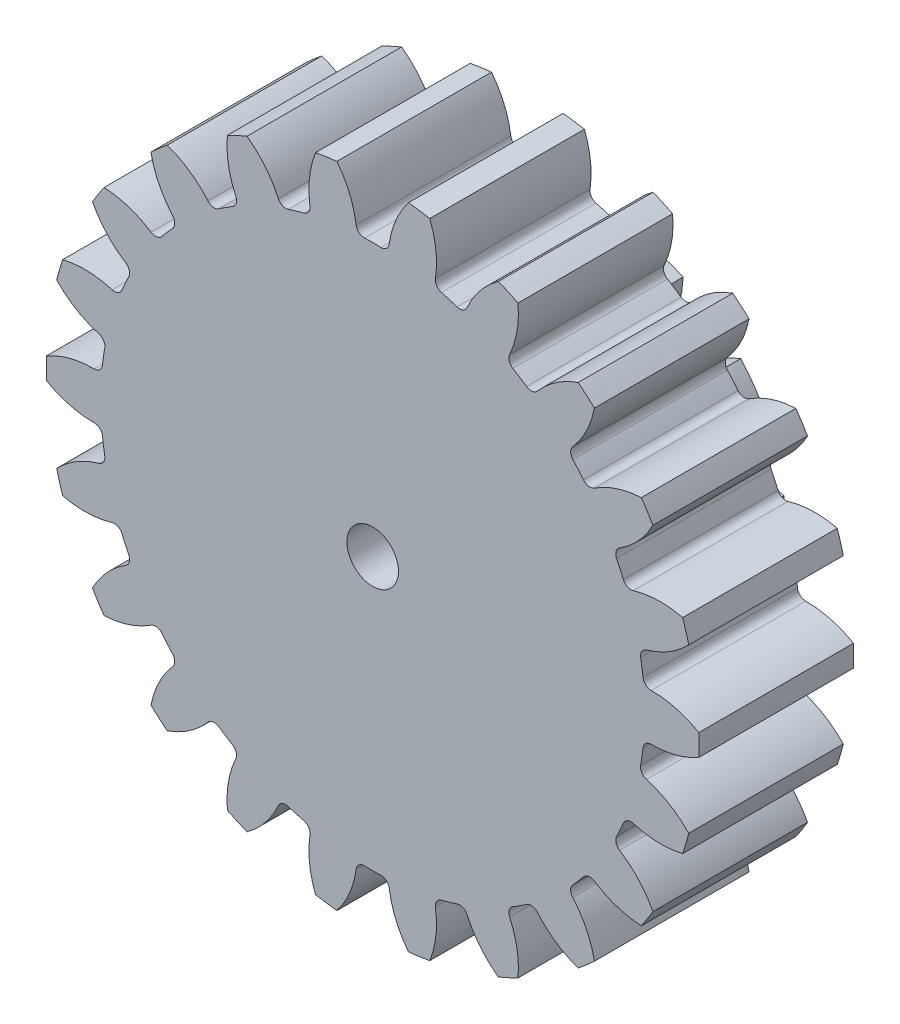
from build123d import *

# Parameters (mm, degrees)
SKETCH1_R                = 10
BOSS_EXTRUDE1_DEPTH      = 2.5
CUT_EXTRUDE1_DEPTH       = 15.361406616
FILLET2_R                = 0.5
CIRPATTERN1_COUNT        = 10
FILLET2_OF_CIRPATTERN1_R = 0.5
SKETCH4_R                = 19
BOSS_EXTRUDE2_DEPTH      = 9
CUT_EXTRUDE2_DEPTH       = 9
FILLET3_R                = 0.475
CIRPATTERN2_COUNT        = 22
FILLET3_OF_CIRPATTERN2_R = 0.475
SKETCH6_R                = 1.5
CUT_EXTRUDE3_DEPTH       = 31.226874344


with BuildPart() as part:
    # Sketch1 → Boss-Extrude1 (new, symmetric)
    with BuildSketch(Plane.XY):
        Circle(SKETCH1_R)
    extrude(amount=BOSS_EXTRUDE1_DEPTH, both=True)

    # Sketch3 → Cut-Extrude1 (cut, symmetric)
    with BuildSketch(Plane.XY):
        with BuildLine():
            ThreePointArc((-2.721939872, 10.657909895), (-1.519639498, 8.762901035), (-0.90177966, 6.605394605))
            ThreePointArc((-0.90177966, 6.605394605), (0, 6.666666667), (0.90177966, 6.605394605))
            ThreePointArc((0.90177966, 6.605394605), (1.519639498, 8.762901035), (2.721939872, 10.657909895))
            ThreePointArc((2.721939872, 10.657909895), (0, 11), (-2.721939872, 10.657909895))
        make_face()
    cut_extrude1 = extrude(amount=CUT_EXTRUDE1_DEPTH, both=True, mode=Mode.SUBTRACT)

    # Fillet2
    fillet2_edges = [part.edges().sort_by_distance(p)[0] for p in [
        (-0.90177966, 6.605394605, 0),
        (0.90177966, 6.605394605, 0),
    ]]
    fillet(fillet2_edges, radius=FILLET2_R)

    # CirPattern1: Cut-Extrude1 ×10 about axis
    cirpattern1_axis = Axis((0, 0, 0), (0, 0, 1))
    for i in range(1, CIRPATTERN1_COUNT):
        add(cut_extrude1.rotate(cirpattern1_axis, i * 360 / CIRPATTERN1_COUNT), mode=Mode.SUBTRACT)

    # Fillet2 of CirPattern1
    fillet2_of_cirpattern1_edges = [part.edges().sort_by_distance(p)[0] for p in [
        (-4.612108605, 4.813823705, 0),
        (-3.152998464, 5.873929275, 0),
        (-6.560768822, 1.183535765, 0),
        (-6.003438342, 2.89882261, 0),
        (-6.003438342, -2.89882261, 0),
        (-6.560768822, -1.183535765, 0),
        (-3.152998464, -5.873929275, 0),
        (-4.612108605, -4.813823705, 0),
        (0.90177966, -6.605394605, 0),
        (-0.90177966, -6.605394605, 0),
        (4.612108605, -4.813823705, 0),
        (3.152998464, -5.873929275, 0),
        (6.560768822, -1.183535765, 0),
        (6.003438342, -2.89882261, 0),
        (6.003438342, 2.89882261, 0),
        (6.560768822, 1.183535765, 0),
        (3.152998464, 5.873929275, 0),
        (4.612108605, 4.813823705, 0),
    ]]
    fillet(fillet2_of_cirpattern1_edges, radius=FILLET2_OF_CIRPATTERN1_R)


with BuildPart() as body_2:
    # Sketch4 → Boss-Extrude2 (new body)
    with BuildSketch(Plane.XY.offset(2.5)):
        Circle(SKETCH4_R)
    extrude(amount=BOSS_EXTRUDE2_DEPTH)

    # Sketch5 → Cut-Extrude2 (cut)
    with BuildSketch(Plane.XY.offset(11.5)):
        with BuildLine():
            ThreePointArc((-2.963435866, 19.779232742), (-1.520960757, 18.00924871), (-0.919276345, 15.806624417))
            ThreePointArc((-0.919276345, 15.806624417), (0, 15.833333333), (0.919276345, 15.806624417))
            ThreePointArc((0.919276345, 15.806624417), (1.520960757, 18.00924871), (2.963435866, 19.779232742))
            ThreePointArc((2.963435866, 19.779232742), (0, 20), (-2.963435866, 19.779232742))
        make_face()
    cut_extrude2 = extrude(amount=-CUT_EXTRUDE2_DEPTH, mode=Mode.SUBTRACT)

    # Fillet3
    fillet3_edges = [body_2.edges().sort_by_distance(p)[0] for p in [
        (-0.919276345, 15.806624417, 7),
        (0.919276345, 15.806624417, 7),
    ]]
    fillet(fillet3_edges, radius=FILLET3_R)

    # CirPattern2: Cut-Extrude2 ×22 about axis
    cirpattern2_axis = Axis((0, 0, 0), (0, 0, 1))
    for i in range(1, CIRPATTERN2_COUNT):
        add(cut_extrude2.rotate(cirpattern2_axis, i * 360 / CIRPATTERN2_COUNT), mode=Mode.SUBTRACT)

    # Fillet3 of CirPattern2
    fillet3_of_cirpattern2_edges = [body_2.edges().sort_by_distance(p)[0] for p in [
        (-5.335279906, 14.907354989, 7),
        (-3.571201518, 15.425335139, 7),
        (-9.319050819, 12.800380318, 7),
        (-7.772361873, 13.794376947, 7),
        (-12.547847657, 9.65639496, 7),
        (-11.343851693, 11.045880373, 7),
        (-14.760092503, 5.730105911, 7),
        (-13.996330113, 7.402512264, 7),
        (-15.776562436, 1.33959776, 7),
        (-15.514909107, 3.159436635, 7),
        (-15.514909107, -3.159436635, 7),
        (-15.776562436, -1.33959776, 7),
        (-13.996330113, -7.402512264, 7),
        (-14.760092503, -5.730105911, 7),
        (-11.343851693, -11.045880373, 7),
        (-12.547847657, -9.65639496, 7),
        (-7.772361873, -13.794376947, 7),
        (-9.319050819, -12.800380318, 7),
        (-3.571201518, -15.425335139, 7),
        (-5.335279906, -14.907354989, 7),
        (0.919276345, -15.806624417, 7),
        (-0.919276345, -15.806624417, 7),
        (5.335279906, -14.907354989, 7),
        (3.571201518, -15.425335139, 7),
        (9.319050819, -12.800380318, 7),
        (7.772361873, -13.794376947, 7),
        (12.547847657, -9.65639496, 7),
        (11.343851693, -11.045880373, 7),
        (14.760092503, -5.730105911, 7),
        (13.996330113, -7.402512264, 7),
        (15.776562436, -1.33959776, 7),
        (15.514909107, -3.159436635, 7),
        (15.514909107, 3.159436635, 7),
        (15.776562436, 1.33959776, 7),
        (13.996330113, 7.402512264, 7),
        (14.760092503, 5.730105911, 7),
        (11.343851693, 11.045880373, 7),
        (12.547847657, 9.65639496, 7),
        (7.772361873, 13.794376947, 7),
        (9.319050819, 12.800380318, 7),
        (3.571201518, 15.425335139, 7),
        (5.335279906, 14.907354989, 7),
    ]]
    fillet(fillet3_of_cirpattern2_edges, radius=FILLET3_OF_CIRPATTERN2_R)


with BuildPart() as cut_extrude3_tool:
    # Sketch6 → Cut-Extrude3 (new, through all)
    with BuildSketch(Plane.XY.offset(11.5)):
        Circle(SKETCH6_R)
    extrude(amount=-CUT_EXTRUDE3_DEPTH)


with BuildPart() as part_1:
    add(part.part)

    # Cut-Extrude3: cut by cut_extrude3_tool
    add(cut_extrude3_tool.part, mode=Mode.SUBTRACT)


with BuildPart() as body_2_1:
    add(body_2.part)

    # Cut-Extrude3: cut by cut_extrude3_tool
    add(cut_extrude3_tool.part, mode=Mode.SUBTRACT)


solid = Compound([part_1.part, body_2_1.part])
